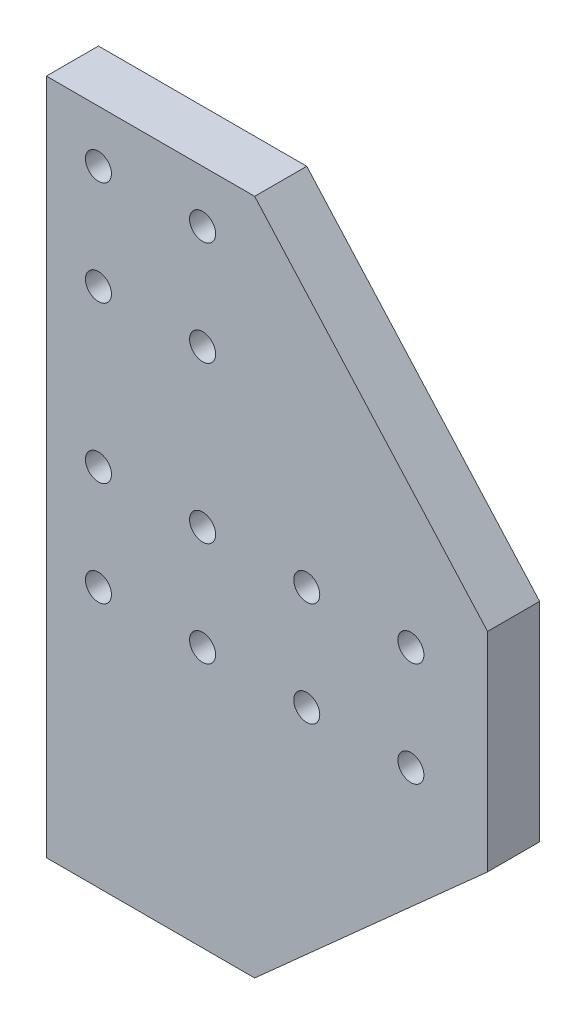
from build123d import *

# Parameters (mm, degrees)
BOSS_EXTRUDE1_DEPTH = 10
SKETCH2_R           = 2.5
CUT_EXTRUDE1_DEPTH  = 10


with BuildPart() as part:
    # Sketch1 → Boss-Extrude1 (new body)
    with BuildSketch(Plane.XY):
        Polygon((0, 0), (40, 0), (84.72135955, 40), (84.72135955, 80), (40, 130), (0, 130), align=None)
    extrude(amount=BOSS_EXTRUDE1_DEPTH)

    # Sketch2 → Cut-Extrude1 (cut)
    with BuildSketch(Plane.XY.offset(10)):
        with Locations((10, 120)):
            Circle(SKETCH2_R)
        with Locations((30, 120)):
            Circle(SKETCH2_R)
        with Locations((10, 100)):
            Circle(SKETCH2_R)
        with Locations((30, 100)):
            Circle(SKETCH2_R)
        with Locations((10, 70)):
            Circle(SKETCH2_R)
        with Locations((30, 70)):
            Circle(SKETCH2_R)
        with Locations((10, 50)):
            Circle(SKETCH2_R)
        with Locations((30, 50)):
            Circle(SKETCH2_R)
        with Locations((50, 70)):
            Circle(SKETCH2_R)
        with Locations((70, 70)):
            Circle(SKETCH2_R)
        with Locations((50, 50)):
            Circle(SKETCH2_R)
        with Locations((70, 50)):
            Circle(SKETCH2_R)
    extrude(amount=-CUT_EXTRUDE1_DEPTH, mode=Mode.SUBTRACT)


solid = part.part
